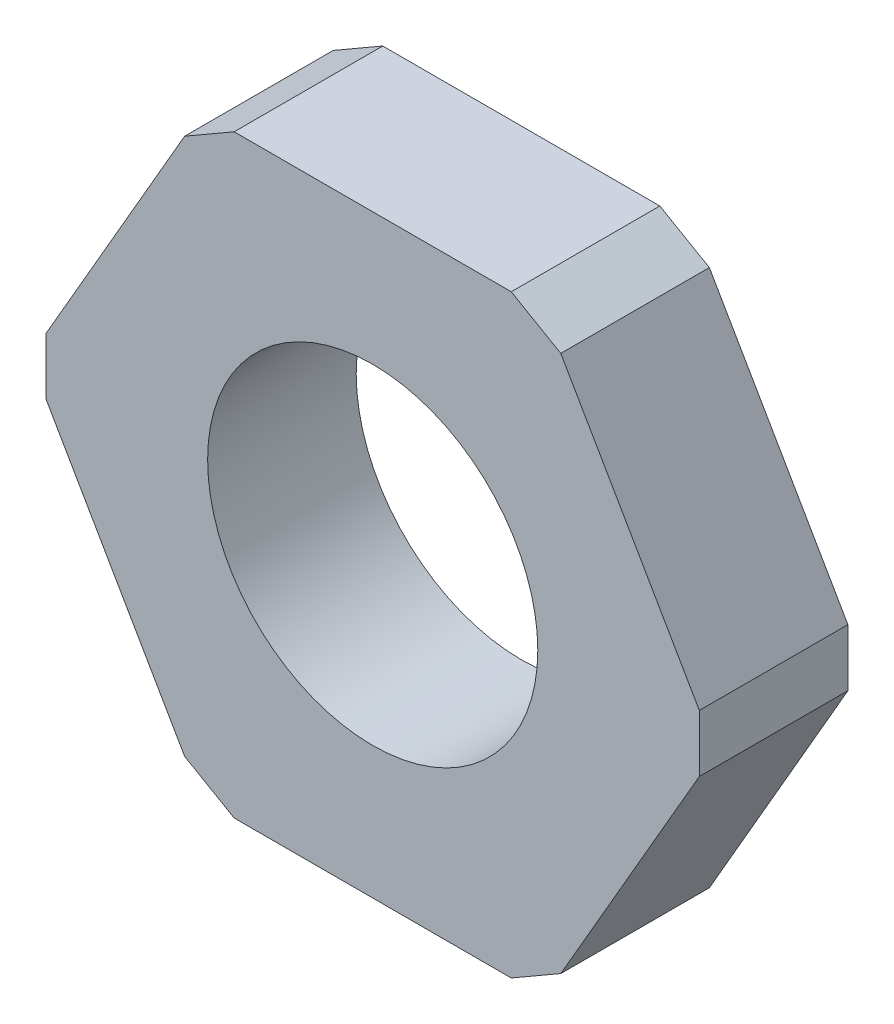
from build123d import *

# Parameters (mm, degrees)
SKETCH_1_R      = 5
EXTRUDE_1_DEPTH = 4.5


with BuildPart() as part:
    # 草圖1 → 填料-伸長1 (new body)
    with BuildSketch(Plane.XY):
        Polygon((-77.948604344, 21.066025404), (-82.144756767, 28.333974596), (-83.644756767, 29.2), (-92.037061613, 29.2), (-93.537061613, 28.333974596), (-97.733214035, 21.066025404), (-97.733214035, 19.333974596), (-93.537061613, 12.066025404), (-92.037061613, 11.2), (-83.644756767, 11.2), (-82.144756767, 12.066025404), (-77.948604344, 19.333974596), align=None)
        with Locations((-87.84090919, 20.2)):
            Circle(SKETCH_1_R, mode=Mode.SUBTRACT)
    extrude(amount=EXTRUDE_1_DEPTH)


solid = part.part
